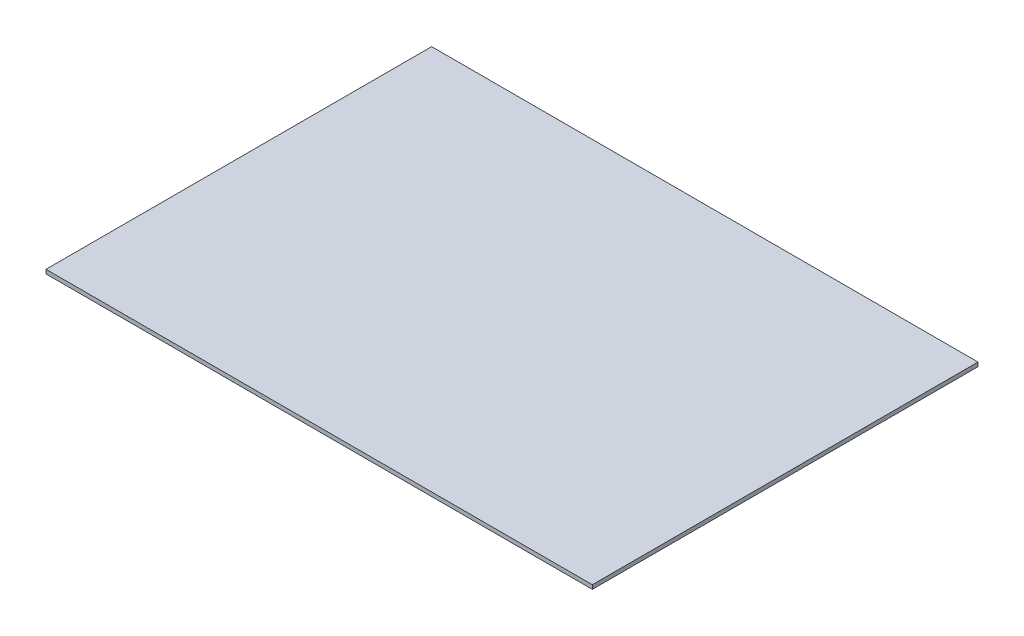
from build123d import *

# Parameters (mm, degrees)
SKETCH1_W           = 431.8
SKETCH1_H           = 304.8
BOSS_EXTRUDE1_DEPTH = 3.175


with BuildPart() as part:
    # Sketch1 → Boss-Extrude1 (new body)
    with BuildSketch(Plane(origin=(0, 0, 0), x_dir=(1, 0, 0), z_dir=(0, 1, 0))):
        with Locations((158.479653034, 90.460969299)):
            Rectangle(SKETCH1_W, SKETCH1_H)
    extrude(amount=BOSS_EXTRUDE1_DEPTH)


solid = part.part
